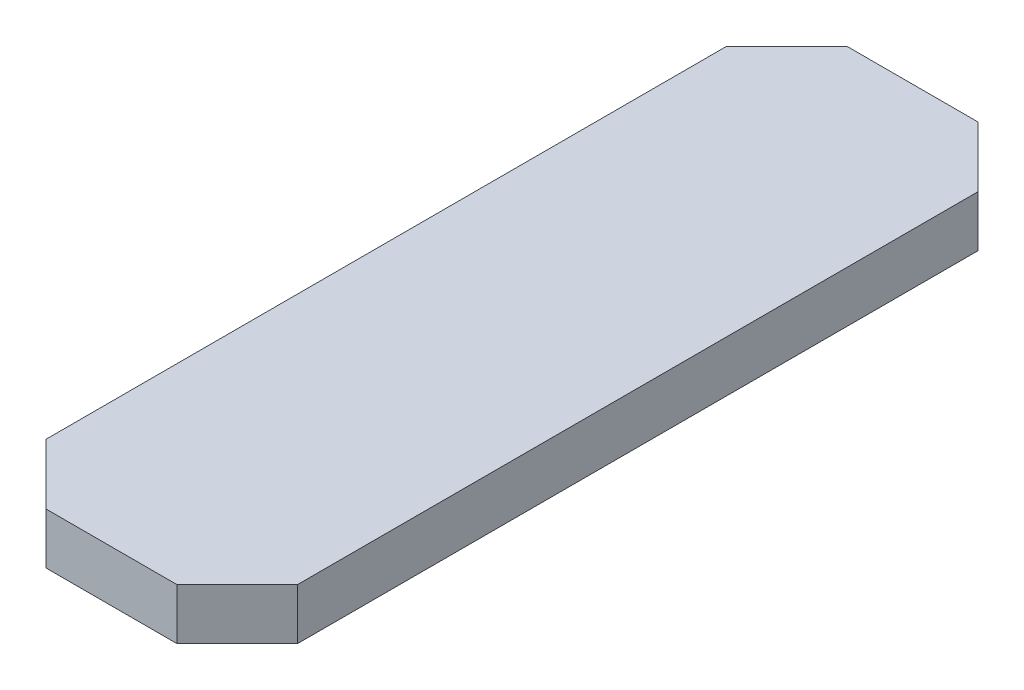
from build123d import *

# Parameters (mm, degrees)
SKETCH1_W           = 125
SKETCH1_H           = 398
BOSS_EXTRUDE1_DEPTH = 25.4
CHAMFER1_SIZE       = 30


with BuildPart() as part:
    # Sketch1 → Boss-Extrude1 (new body)
    with BuildSketch(Plane(origin=(0, 0, 0), x_dir=(1, 0, 0), z_dir=(0, 1, 0))):
        Rectangle(SKETCH1_W, SKETCH1_H)
    extrude(amount=BOSS_EXTRUDE1_DEPTH)

    # Chamfer1
    chamfer1_edges = [part.edges().sort_by_distance(p)[0] for p in [
        (62.5, 12.7, 199),
        (-62.5, 12.7, 199),
        (-62.5, 12.7, -199),
        (62.5, 12.7, -199),
    ]]
    chamfer(chamfer1_edges, length=CHAMFER1_SIZE)


solid = part.part
